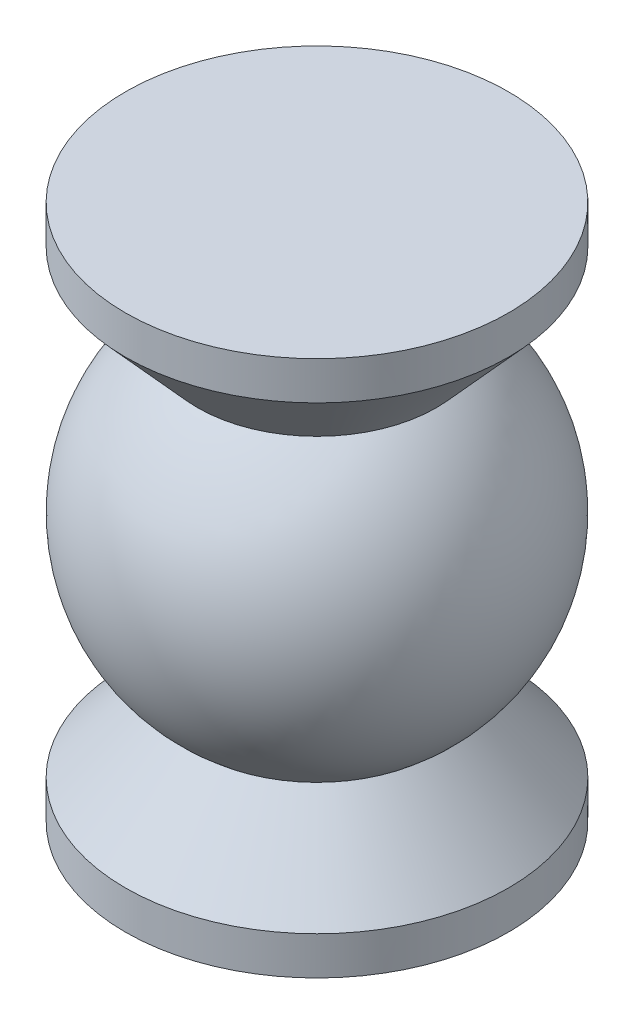
from build123d import *

# Parameters (mm, degrees)
SKETCH_1_R      = 25
EXTRUDE_1_DEPTH = 5


with BuildPart() as part:
    # 草图1 → 凸台-拉伸1 (new body)
    with BuildSketch(Plane(origin=(0, 0, 0), x_dir=(1, 0, 0), z_dir=(0, 1, 0))):
        with Locations(Location((0, 0, 0), (0, 0, 270))):
            Circle(SKETCH_1_R)
    extrude_1 = extrude(amount=-EXTRUDE_1_DEPTH)

    # 草图9 → 旋转20 (revolve)
    with BuildSketch(Plane.XY):
        with BuildLine():
            Line((15.572827559, -15.442724069), (25, -5))
            Line((25, -5), (0, -5))
            Line((0, -5), (0, -65))
            Line((0, -65), (25, -65))
            Line((25, -65), (15.572827559, -54.557275931))
            ThreePointArc((15.572827559, -54.557275931), (25, -35), (15.572827559, -15.442724069))
        make_face()
    revolve(axis=Axis((0, 51.125830707, 0), (0, -1, 0)))

    # 镜向1: 凸台-拉伸1 across plane
    add(extrude_1.mirror(Plane.ZX.offset(-35)))


solid = part.part
